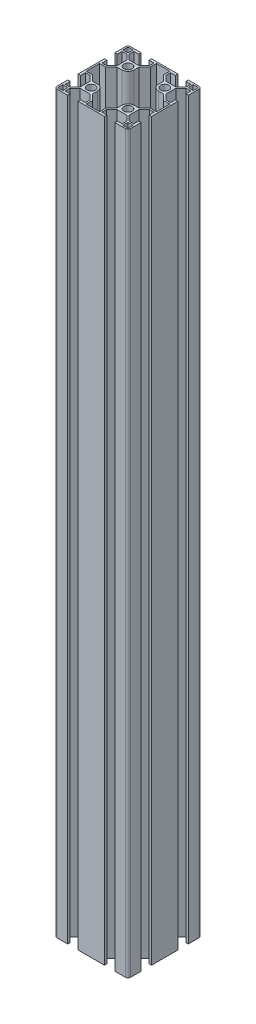
from build123d import *

# Parameters (mm, degrees)
SKETCH_1_R      = 3.4
SKETCH_1_W      = 4.15
SKETCH_1_H      = 4.15
EXTRUDE_1_DEPTH = 600
FILLET_1_R      = 0.7
FILLET_2_R      = 2
FILLET_3_R      = 5


with BuildPart() as part:
    # 草图1 → 凸台-拉伸1 (new body)
    with BuildSketch(Plane(origin=(0, 0, 0), x_dir=(1, 0, 0), z_dir=(0, 1, 0))):
        Polygon((-30, 30), (-19.2, 30), (-19.2, 28), (-23.25, 28), (-23.25, 24.169238816), (-19.080761184, 20), (-10.919238816, 20), (-6.75, 24.169238816), (-6.75, 28), (-10.8, 28), (-10.8, 30), (10.8, 30), (10.8, 28), (6.75, 28), (6.75, 24.169238816), (10.919238816, 20), (19.080761184, 20), (23.25, 24.169238816), (23.25, 28), (19.2, 28), (19.2, 30), (30, 30), (30, 19.2), (28, 19.2), (28, 23.25), (24.169238816, 23.25), (20, 19.080761184), (20, 10.919238816), (24.169238816, 6.75), (28, 6.75), (28, 10.8), (30, 10.8), (30, -10.8), (28, -10.8), (28, -6.75), (24.169238816, -6.75), (20, -10.919238816), (20, -19.080761184), (24.169238816, -23.25), (28, -23.25), (28, -19.2), (30, -19.2), (30, -30), (19.2, -30), (19.2, -28), (23.25, -28), (23.25, -24.169238816), (19.080761184, -20), (10.919238816, -20), (6.75, -24.169238816), (6.75, -28), (10.8, -28), (10.8, -30), (-10.8, -30), (-10.8, -28), (-6.75, -28), (-6.75, -24.169238816), (-10.919238816, -20), (-19.080761184, -20), (-23.25, -24.169238816), (-23.25, -28), (-19.2, -28), (-19.2, -30), (-30, -30), (-30, -19.2), (-28, -19.2), (-28, -23.25), (-24.169238816, -23.25), (-20, -19.080761184), (-20, -10.919238816), (-24.169238816, -6.75), (-28, -6.75), (-28, -10.8), (-30, -10.8), (-30, 10.8), (-28, 10.8), (-28, 6.75), (-24.169238816, 6.75), (-20, 10.919238816), (-20, 19.080761184), (-24.169238816, 23.25), (-28, 23.25), (-28, 19.2), (-30, 19.2), align=None)
        with Locations(Location((-15, 15, 0), (0, 0, 270))):
            Circle(SKETCH_1_R, mode=Mode.SUBTRACT)
        with Locations(Location((15, 15, 0), (0, 0, 270))):
            Circle(SKETCH_1_R, mode=Mode.SUBTRACT)
        with Locations(Location((15, -15, 0), (0, 0, 270))):
            Circle(SKETCH_1_R, mode=Mode.SUBTRACT)
        with Locations(Location((-15, -15, 0), (0, 0, 270))):
            Circle(SKETCH_1_R, mode=Mode.SUBTRACT)
        Polygon((-5.45, 28), (-5.45, 28.7), (5.45, 28.7), (5.45, 28), (5.45, 23.630761184), (10, 19.080761184), (10, 10), (19.080761184, 10), (23.630761184, 5.45), (28, 5.45), (28.7, 5.45), (28.7, -5.45), (28, -5.45), (23.630761184, -5.45), (19.080761184, -10), (10, -10), (10, -19.080761184), (5.45, -23.630761184), (5.45, -28), (5.45, -28.7), (-5.45, -28.7), (-5.45, -28), (-5.45, -23.630761184), (-10, -19.080761184), (-10, -10), (-19.080761184, -10), (-23.630761184, -5.45), (-28, -5.45), (-28.7, -5.45), (-28.7, 5.45), (-28, 5.45), (-23.630761184, 5.45), (-19.080761184, 10), (-10, 10), (-10, 19.080761184), (-5.45, 23.630761184), align=None, mode=Mode.SUBTRACT)
        with Locations((-26.625, 26.625)):
            Rectangle(SKETCH_1_W, SKETCH_1_H, mode=Mode.SUBTRACT)
        with Locations((26.625, 26.625)):
            Rectangle(SKETCH_1_W, SKETCH_1_H, mode=Mode.SUBTRACT)
        with Locations((26.625, -26.625)):
            Rectangle(SKETCH_1_W, SKETCH_1_H, mode=Mode.SUBTRACT)
        with Locations((-26.625, -26.625)):
            Rectangle(SKETCH_1_W, SKETCH_1_H, mode=Mode.SUBTRACT)
    extrude(amount=EXTRUDE_1_DEPTH)

    # 圆角1
    fillet_1_edges = [part.edges().sort_by_distance(p)[0] for p in [
        (28.7, 300, 28.7),
        (28.7, 300, -28.7),
        (-28.7, 300, -28.7),
        (-28.7, 300, 28.7),
    ]]
    fillet(fillet_1_edges, radius=FILLET_1_R)

    # 圆角2
    fillet_2_edges = [part.edges().sort_by_distance(p)[0] for p in [
        (30, 300, -30),
        (30, 300, 30),
        (-30, 300, 30),
        (-30, 300, -30),
    ]]
    fillet(fillet_2_edges, radius=FILLET_2_R)

    # 圆角3
    fillet_3_edges = [part.edges().sort_by_distance(p)[0] for p in [
        (10, 300, 10),
        (10, 300, -10),
        (-10, 300, -10),
        (-10, 300, 10),
    ]]
    fillet(fillet_3_edges, radius=FILLET_3_R)


solid = part.part
